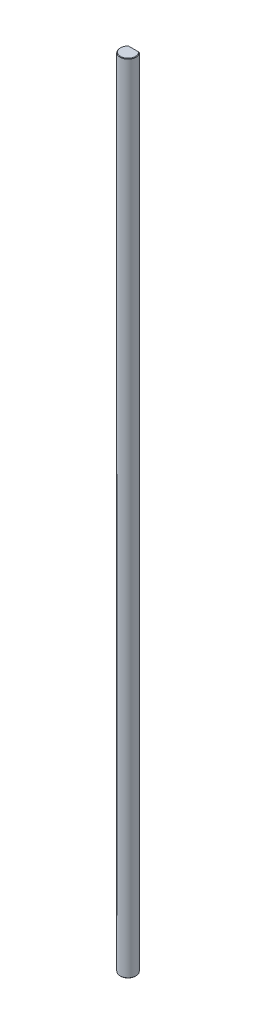
from build123d import *

# Parameters (mm, degrees)
SKETCH1_R               = 4
BOSS_EXTRUDE1_DEPTH     = 400
CUT_EXTRUDE1_DEPTH      = 401.039998
CUT_EXTRUDE1_DEPTH_BACK = 401.039998
CHAMFER1_SIZE           = 0.25


with BuildPart() as part:
    # Sketch1 → Boss-Extrude1 (new body)
    with BuildSketch(Plane(origin=(0, 0, 0), x_dir=(1, 0, 0), z_dir=(0, 1, 0))):
        with Locations(Location((0, 0, 0), (0, 0, 270))):
            Circle(SKETCH1_R)
    extrude(amount=BOSS_EXTRUDE1_DEPTH)

    # Sketch2 → Cut-Extrude1 (cut, two sides: drawn at the far end of the back side and taken through both)
    with BuildSketch(Plane(origin=(0, 400, 0), x_dir=(1, 0, 0), z_dir=(0, 1, 0)).offset(-CUT_EXTRUDE1_DEPTH_BACK)):
        with BuildLine():
            Line((-4, 3), (4, 3))
            ThreePointArc((4, 3), (0, 5), (-4, 3))
        make_face()
    extrude(amount=CUT_EXTRUDE1_DEPTH + CUT_EXTRUDE1_DEPTH_BACK, mode=Mode.SUBTRACT)

    # Chamfer1
    chamfer1_edges = [part.edges().sort_by_distance(p)[0] for p in [
        (0, 0, 4),
        (0, 0, -3),
        (0, 400, 4),
        (0, 400, -3),
    ]]
    chamfer(chamfer1_edges, length=CHAMFER1_SIZE)


solid = part.part
